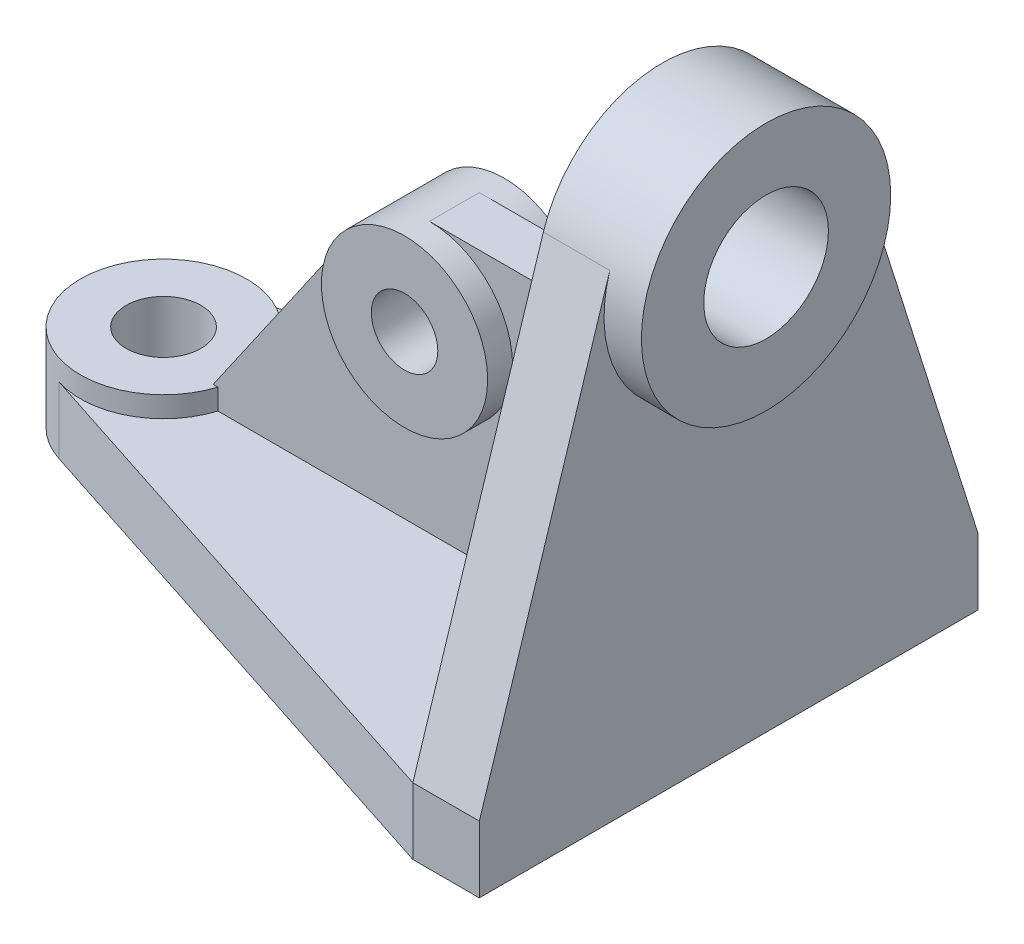
from build123d import *

# Parameters (mm, degrees)
SKETCH1_R           = 9
BOSS_EXTRUDE3_DEPTH = 21
BOSS_EXTRUDE4_DEPTH = 16
BOSS_EXTRUDE5_START = -16
SKETCH2_R           = 15
BOSS_EXTRUDE5_DEPTH = 25
BOSS_EXTRUDE6_DEPTH = 16
SKETCH4_R           = 8
BOSS_EXTRUDE7_DEPTH = 12
BOSS_EXTRUDE9_DEPTH = 6


with BuildPart() as part:
    # Sketch1 → Boss-Extrude3 (new body)
    with BuildSketch(Plane(origin=(0, 0, 0), x_dir=(1, 0, 0), z_dir=(0, 1, 0))):
        with BuildLine():
            ThreePointArc((20, 0), (11.756842217, 16.179513623), (-6.177666108, 19.021998882))
            ThreePointArc((-6.177666108, 19.021998882), (-20, 0), (-6.177666108, -19.021998882))
            ThreePointArc((-6.177666108, -19.021998882), (11.756842217, -16.179513623), (20, 0))
        make_face()
        Circle(SKETCH1_R, mode=Mode.SUBTRACT)
    extrude(amount=BOSS_EXTRUDE3_DEPTH)

    # Sketch1<5> → Boss-Extrude4 (add)
    with BuildSketch(Plane(origin=(0, 0, 0), x_dir=(1, 0, 0), z_dir=(0, 1, 0))):
        with BuildLine():
            ThreePointArc((-6.177666108, 19.021998882), (20, 0), (-6.177666108, -19.021998882))
            Line((-6.177666108, -19.021998882), (120, -60))
            Line((120, -60), (136, -60))
            Line((136, -60), (136, 60))
            Line((136, 60), (120, 60))
            Line((120, 60), (-6.177666108, 19.021998882))
        make_face()
    extrude(amount=BOSS_EXTRUDE4_DEPTH)



with BuildPart() as body_2:
    # Sketch2 → Boss-Extrude5 (new body)
    with BuildSketch(Plane(origin=(136, 0, 0), x_dir=(0, 0, -1), z_dir=(1, 0, 0)).offset(BOSS_EXTRUDE5_START)):
        with BuildLine():
            ThreePointArc((-28.597626566, 115.065084378), (-4.586458493, 76.35266625), (30, 106))
            ThreePointArc((30, 106), (29.64733375, 110.586458493), (28.597626566, 115.065084378))
            ThreePointArc((28.597626566, 115.065084378), (0, 136), (-28.597626566, 115.065084378))
        make_face()
        with Locations((0, 106)):
            Circle(SKETCH2_R, mode=Mode.SUBTRACT)
    extrude(amount=BOSS_EXTRUDE5_DEPTH)


with BuildPart() as part_1:
    add(part.part)

    add(body_2.part)  # Boss-Extrude6 merges body 2
    # Sketch2<4> → Boss-Extrude6 (add)
    with BuildSketch(Plane(origin=(136, 0, 0), x_dir=(0, 0, -1), z_dir=(1, 0, 0))):
        with BuildLine():
            Line((-28.597626566, 115.065084378), (-60, 16))
            Line((-60, 16), (60, 16))
            Line((60, 16), (28.597626566, 115.065084378))
            ThreePointArc((28.597626566, 115.065084378), (29.64733375, 110.586458493), (30, 106))
            ThreePointArc((30, 106), (-4.586458493, 76.35266625), (-28.597626566, 115.065084378))
        make_face()
    extrude(amount=-BOSS_EXTRUDE6_DEPTH)



with BuildPart() as body_2_2:
    # Sketch4 → Boss-Extrude7 (new, symmetric)
    with BuildSketch(Plane.XY):
        with BuildLine():
            ThreePointArc((90, 61), (84.142135624, 75.142135624), (70, 81))
            ThreePointArc((70, 81), (60.721079538, 78.717269402), (53.560286641, 72.390163506))
            ThreePointArc((53.560286641, 72.390163506), (64.033186243, 41.910811081), (90, 61))
        make_face()
        with Locations((70, 61)):
            Circle(SKETCH4_R, mode=Mode.SUBTRACT)
    extrude(amount=BOSS_EXTRUDE7_DEPTH, both=True)


with BuildPart() as part_2:
    add(part_1.part)

    add(body_2_2.part)  # Boss-Extrude9 merges body 2 2
    # Sketch4<4> → Boss-Extrude9 (add, symmetric)
    with BuildSketch(Plane.XY):
        with BuildLine():
            Line((120, 81), (70, 81))
            ThreePointArc((70, 81), (84.142135624, 75.142135624), (90, 61))
            ThreePointArc((90, 61), (64.033186243, 41.910811081), (53.560286641, 72.390163506))
            Line((53.560286641, 72.390163506), (17.954899118, 21))
            Line((17.954899118, 21), (17.954899118, 16))
            Line((17.954899118, 16), (20, 16))
            Line((20, 16), (120, 16))
            Line((120, 16), (120, 81))
        make_face()
    extrude(amount=BOSS_EXTRUDE9_DEPTH, both=True)


solid = part_2.part
